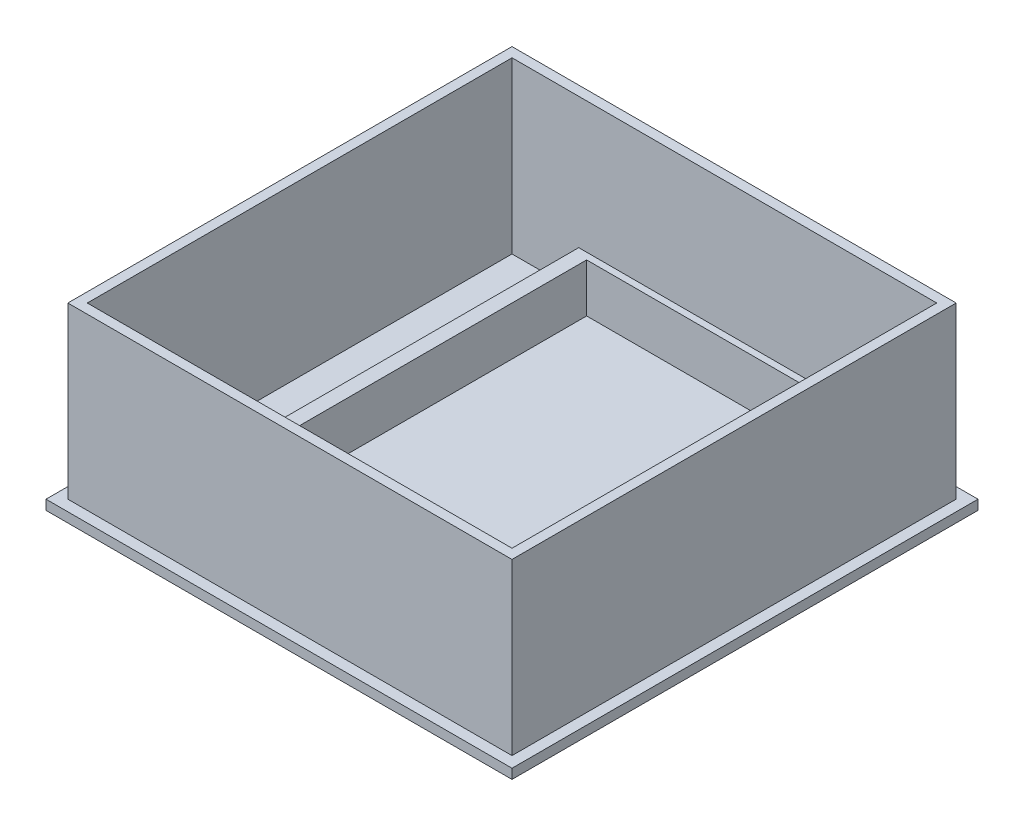
from build123d import *

# Parameters (mm, degrees)
SKETCH1_W            = 100
SKETCH1_H            = 100
BOSS_EXTRUDE1_DEPTH  = 4
SKETCH2_W            = 91.5
SKETCH2_H            = 91.5
SKETCH2_W_2          = 83.5
SKETCH2_H_2          = 83.5
BOSS_EXTRUDE2_DEPTH  = 35
SKETCH3_W            = 4
SKETCH3_H            = 4
CUT_EXTRUDE1_DEPTH   = 4
SKETCH4_W            = 26
SKETCH4_H            = 2.75
SKETCH4_W_2          = 3
SKETCH4_H_2          = 44.42
BOSS_EXTRUDE3_DEPTH  = 10
SKETCH5_W            = 50
SKETCH5_H            = 1.375
CUT_EXTRUDE2_DEPTH   = 79.89866919
SKETCH7_W            = 4
SKETCH7_H            = 4
BOSS_EXTRUDE5_DEPTH  = 4
SKETCH8_W            = 87.495245403
SKETCH8_H            = 87.5
CUT_EXTRUDE6_DEPTH   = 25
SKETCH10_W           = 87.495245403
SKETCH10_H           = 87.5
SKETCH10_W_2         = 83.5
SKETCH10_H_2         = 83.5
CUT_EXTRUDE8_DEPTH   = 10
SKETCH11_OUTSIDE_W   = 131.34
SKETCH11_OUTSIDE_H   = 131.34
SKETCH11_OUTSIDE_W_2 = 96
SKETCH11_OUTSIDE_H_2 = 96
CUT_EXTRUDE9_DEPTH   = 32
SKETCH12_W           = 96
SKETCH12_H           = 2
CUT_EXTRUDE10_DEPTH  = 115.197197864


with BuildPart() as part:
    # Sketch1 → Boss-Extrude1 (new body)
    with BuildSketch(Plane(origin=(0, 0, 0), x_dir=(1, 0, 0), z_dir=(0, 1, 0))):
        Rectangle(SKETCH1_W, SKETCH1_H)
    extrude(amount=BOSS_EXTRUDE1_DEPTH)

    # Sketch2 → Boss-Extrude2 (add)
    with BuildSketch(Plane(origin=(0, 4, 0), x_dir=(1, 0, 0), z_dir=(0, 1, 0))):
        Rectangle(SKETCH2_W, SKETCH2_H)
        Rectangle(SKETCH2_W_2, SKETCH2_H_2, mode=Mode.SUBTRACT)
    extrude(amount=BOSS_EXTRUDE2_DEPTH)

    # Sketch3 → Cut-Extrude1 (cut)
    with BuildSketch(Plane(origin=(0, 0, -45.75), x_dir=(-1, 0, 0), z_dir=(0, 0, -1))):
        with Locations((0, 6)):
            Rectangle(SKETCH3_W, SKETCH3_H)
    extrude(amount=-CUT_EXTRUDE1_DEPTH, mode=Mode.SUBTRACT)

    # Sketch4 → Boss-Extrude3 (add)
    with BuildSketch(Plane(origin=(0, 4, 0), x_dir=(1, 0, 0), z_dir=(0, 1, 0))):
        Polygon((-28, 22.21), (-25, 22.21), (-25, 39), (-13, 39), (-13, 41.75), (-28, 41.75), align=None)
        Polygon((25, 39), (25, 22.21), (28, 22.21), (28, 41.75), (13, 41.75), (13, 39), align=None)
        Polygon((25, -39), (13, -39), (13, -41.75), (28, -41.75), (28, -22.21), (25, -22.21), align=None)
        Polygon((-13, -39), (-25, -39), (-25, -22.21), (-28, -22.21), (-28, -41.75), (-13, -41.75), align=None)
        with Locations((0, -40.375)):
            Rectangle(SKETCH4_W, SKETCH4_H)
        with Locations((-26.5, 0)):
            Rectangle(SKETCH4_W_2, SKETCH4_H_2)
        with Locations((0, 40.375)):
            Rectangle(SKETCH4_W, SKETCH4_H)
        with Locations((26.5, 0)):
            Rectangle(SKETCH4_W_2, SKETCH4_H_2)
    extrude(amount=BOSS_EXTRUDE3_DEPTH)

    # Sketch5 → Cut-Extrude2 (cut, through all)
    with BuildSketch(Plane(origin=(0, 4, 0), x_dir=(1, 0, 0), z_dir=(0, 1, 0))):
        with Locations((0, 39.6875)):
            Rectangle(SKETCH5_W, SKETCH5_H)
    extrude(amount=CUT_EXTRUDE2_DEPTH, mode=Mode.SUBTRACT)

    # Sketch7 → Boss-Extrude5 (add)
    with BuildSketch(Plane(origin=(0, 0, -45.75), x_dir=(-1, 0, 0), z_dir=(0, 0, -1))):
        with Locations((0, 6)):
            Rectangle(SKETCH7_W, SKETCH7_H)
    extrude(amount=-BOSS_EXTRUDE5_DEPTH)

    # Sketch8 → Cut-Extrude6 (cut)
    with BuildSketch(Plane(origin=(0, 39, 0), x_dir=(1, 0, 0), z_dir=(0, 1, 0))):
        with Locations((0.002377298, 0)):
            Rectangle(SKETCH8_W, SKETCH8_H)
    extrude(amount=-CUT_EXTRUDE6_DEPTH, mode=Mode.SUBTRACT)

    # Sketch10 → Cut-Extrude8 (cut)
    with BuildSketch(Plane(origin=(0, 14, 0), x_dir=(1, 0, 0), z_dir=(0, 1, 0))):
        with Locations((0.002377298, 0)):
            Rectangle(SKETCH10_W, SKETCH10_H)
        Rectangle(SKETCH10_W_2, SKETCH10_H_2, mode=Mode.SUBTRACT)
    extrude(amount=-CUT_EXTRUDE8_DEPTH, mode=Mode.SUBTRACT)

    # Sketch11 outside → Cut-Extrude9 (cut)
    with BuildSketch(Plane(origin=(0, 4, 0), x_dir=(1, 0, 0), z_dir=(0, 1, 0))):
        Rectangle(SKETCH11_OUTSIDE_W, SKETCH11_OUTSIDE_H)
        Rectangle(SKETCH11_OUTSIDE_W_2, SKETCH11_OUTSIDE_H_2, mode=Mode.SUBTRACT)
    extrude(amount=-CUT_EXTRUDE9_DEPTH, mode=Mode.SUBTRACT)

    # Sketch12 → Cut-Extrude10 (cut, through all)
    with BuildSketch(Plane(origin=(0, 0, -48), x_dir=(-1, 0, 0), z_dir=(0, 0, -1))):
        with Locations((0, 1)):
            Rectangle(SKETCH12_W, SKETCH12_H)
    extrude(amount=-CUT_EXTRUDE10_DEPTH, mode=Mode.SUBTRACT)


solid = part.part
